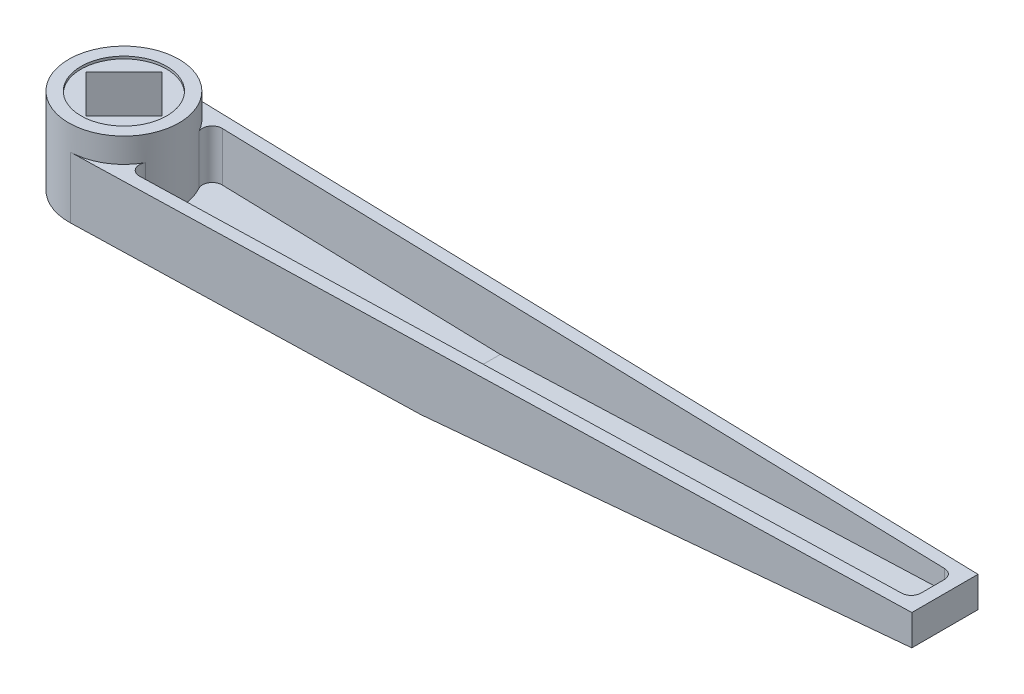
from build123d import *

# Parameters (mm, degrees)
EXTRUDE_X1_DEPTH          = 25
CUT_EXTRUDE_X2_DEPTH      = 337.68365599
CUT_EXTRUDE_X2_DEPTH_BACK = 337.68365599
SHELL_S1_T                = -5
SKETCH_C_R                = 22.5
EXTRUDE_X3_DEPTH          = 35
SKETCH_D_R                = 17.5
CUT_EXTRUDE_X5_DEPTH      = 1
CUT_EXTRUDE_START         = -1
SKETCH_E_R                = 17.5
CUT_EXTRUDE_X6_DEPTH      = 1
CUT_EXTRUDE_X7_DEPTH      = 338.471850678
FILLET_F1_R               = 4


with BuildPart() as part:
    # Sketch A → Extrude X1 (new body)
    with BuildSketch(Plane(origin=(0, 0, 0), x_dir=(1, 0, 0), z_dir=(0, 1, 0))):
        Polygon((0.604805244, 22.491869878), (335, 13.5), (335, -13.5), (0.604805244, -22.491869878), align=None)
    extrude(amount=EXTRUDE_X1_DEPTH)

    # Sketch B → Cut-Extrude X2 (cut, two sides: drawn at the far end of the back side and taken through both)
    with BuildSketch(Plane.XY.offset(-CUT_EXTRUDE_X2_DEPTH_BACK)):
        Polygon((335, 12.5), (140, 0), (140, -74.146668182), (362.466184873, -74.146668182), (356.911911272, 12.5), align=None)
    extrude(amount=CUT_EXTRUDE_X2_DEPTH + CUT_EXTRUDE_X2_DEPTH_BACK, mode=Mode.SUBTRACT)

    # Shell S1
    shell_s1_openings = [part.faces().sort_by_distance(p)[0] for p in [
        (153.878711478, 25, 0),
        (0.604805244, 12.5, 0),
    ]]
    offset(amount=SHELL_S1_T, openings=shell_s1_openings, kind=Kind.INTERSECTION)

    # Sketch C → Extrude X3 (add)
    with BuildSketch(Plane(origin=(0, 0, 0), x_dir=(1, 0, 0), z_dir=(0, 1, 0))):
        with Locations(Location((0, 0, 0), (0, 0, 88.459690565))):
            Circle(SKETCH_C_R)
    extrude(amount=EXTRUDE_X3_DEPTH)

    # Sketch D → Cut-Extrude X5 (cut)
    with BuildSketch(Plane(origin=(0, 35, 0), x_dir=(1, 0, 0), z_dir=(0, 1, 0))):
        with Locations(Location((0, 0, 0), (0, 0, 270))):
            Circle(SKETCH_D_R)
    extrude(amount=-CUT_EXTRUDE_X5_DEPTH, mode=Mode.SUBTRACT)

    # Sketch E → Cut-Extrude X6 (cut)
    with BuildSketch(Plane.XZ.offset(CUT_EXTRUDE_START)):
        with Locations(Location((0, 0, 0), (0, 0, 90))):
            Circle(SKETCH_E_R)
    extrude(amount=CUT_EXTRUDE_X6_DEPTH, mode=Mode.SUBTRACT)

    # Sketch F → Cut-Extrude X7 (cut, through all)
    with BuildSketch(Plane(origin=(0, 1, 0), x_dir=(1, 0, 0), z_dir=(0, 1, 0))):
        Polygon((0, 15.556349186), (-15.556349186, 0), (0, -15.556349186), (15.556349186, 0), align=None)
    extrude(amount=CUT_EXTRUDE_X7_DEPTH, mode=Mode.SUBTRACT)

    # Fillet F1
    fillet_f1_edges = [part.edges().sort_by_distance(p)[0] for p in [
        (330, 21.094874747, 8.6326424),
        (330, 21.094874747, -8.6326424),
        (14.607429601, 15, -17.11353267),
        (14.607429601, 15, 17.11353267),
    ]]
    fillet(fillet_f1_edges, radius=FILLET_F1_R)


solid = part.part
